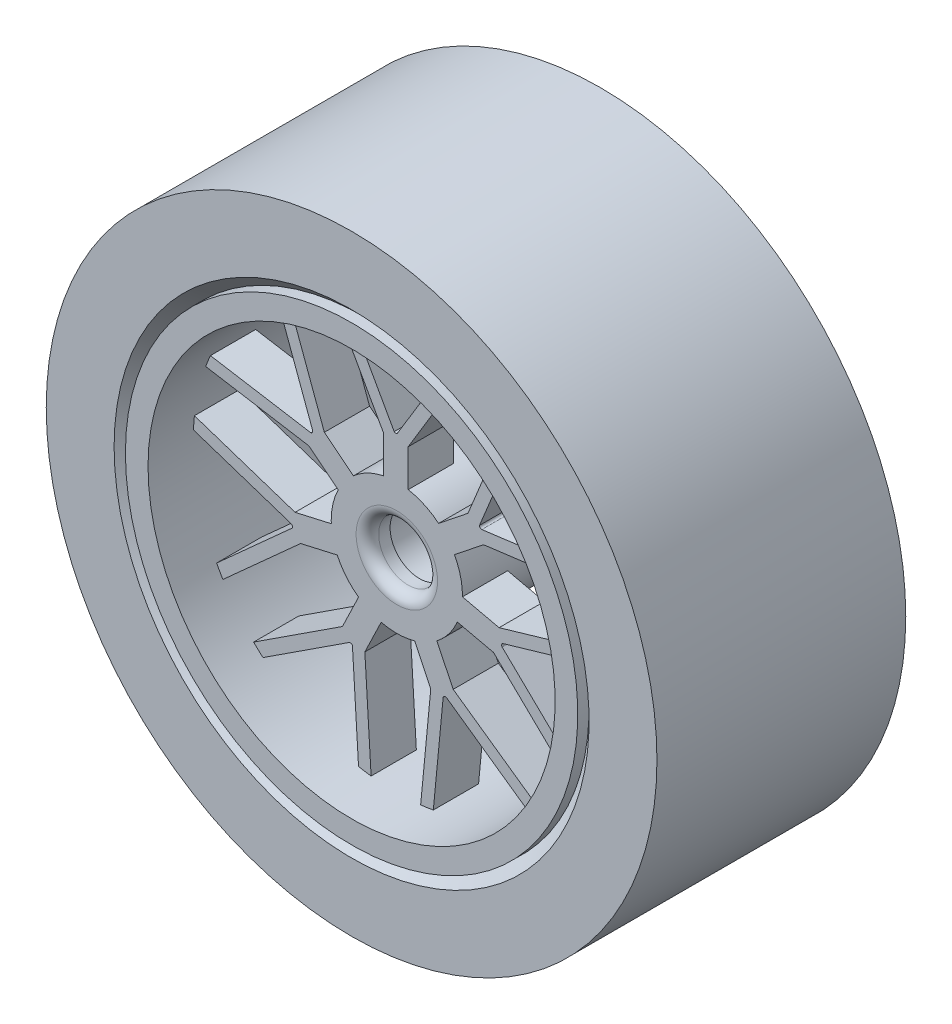
from build123d import *

# Parameters (mm, degrees)
CUT_EXTRUDE1_START  = -9
SKETCH3_R           = 9
SKETCH3_R_2         = 2.9
CUT_EXTRUDE1_DEPTH  = 9
BOSS_EXTRUDE1_DEPTH = 2
CIRPATTERN1_COUNT   = 7
SKETCH5_R           = 2.9
SKETCH5_R_2         = 1.3
BOSS_EXTRUDE2_DEPTH = 1
FILLET2_R           = 0.5


with BuildPart() as part:
    # Sketch1 → Revolve1 (revolve)
    with BuildSketch(Plane(origin=(0, 0, 0), x_dir=(1, 0, 0), z_dir=(0, 1, 0))):
        Polygon((-1.7, 0), (-1.7, -5), (-1.4, -5.5), (-1.5, -6), (-1.5, -8), (-2.5, -8), (-2.5, -9), (-9, -9), (-9, -11), (-10, -11), (-10, -10.5), (-10.5, -11), (-13.5, -11), (-13.5, 0), align=None)
    revolve(axis=Axis((0, 0, 0), (0, 0, 1)))

    # Sketch3 → Cut-Extrude1 (cut)
    with BuildSketch(Plane(origin=(0, 0, 0), x_dir=(-1, 0, 0), z_dir=(0, 0, -1)).offset(CUT_EXTRUDE1_START)):
        Circle(SKETCH3_R)
        Circle(SKETCH3_R_2, mode=Mode.SUBTRACT)
    extrude(amount=CUT_EXTRUDE1_DEPTH, mode=Mode.SUBTRACT)


with BuildPart() as cut_extrude1_piece_1:
    # of the separate pieces the step leaves, piece 1, a body of its own (cut_extrude1_pieces)
    add(part.part.solids().sort_by_distance((-13.5, 0, 0))[0])

    # Sketch2 → Boss-Extrude1 (add)
    with BuildSketch(Plane.XY.offset(9)):
        with BuildLine():
            Line((-0.597826087, 4.5), (-2.848883013, 8.537204787))
            Line((-2.848883013, 8.537204787), (-2.342145206, 8.757766839))
            Line((-2.342145206, 8.757766839), (-0.117452618, 4.767845721))
            ThreePointArc((-0.117452618, 4.767845721), (-0.039367839, 4.74545664), (0.031677909, 4.784839446))
            Line((0.031677909, 4.784839446), (2.436897987, 8.757766839))
            Line((2.436897987, 8.757766839), (2.929718633, 8.509803096))
            Line((2.929718633, 8.509803096), (0.502173913, 4.5))
            Line((0.502173913, 4.5), (0.502173913, 2.44904499))
            ThreePointArc((0.502173913, 2.44904499), (-0.049135224, 2.504998888), (-0.597826087, 2.427468634))
            Line((-0.597826087, 2.427468634), (-0.597826087, 4.5))
        make_face()
    boss_extrude1 = extrude(amount=-BOSS_EXTRUDE1_DEPTH)

    # CirPattern1: Boss-Extrude1 ×7 about axis
    cirpattern1_axis = Axis((0, 0, 0), (0, 0, 1))
    for i in range(1, CIRPATTERN1_COUNT):
        add(boss_extrude1.rotate(cirpattern1_axis, i * 360 / CIRPATTERN1_COUNT))



with BuildPart() as cut_extrude1_piece_2:
    # of the separate pieces the step leaves, piece 2, a body of its own (cut_extrude1_pieces)
    add(part.part.solids().sort_by_distance((-1.7, 0, 0))[0])


with BuildPart() as cut_extrude1_piece_1_1:
    add(cut_extrude1_piece_1.part)

    add(cut_extrude1_piece_2.part)  # Boss-Extrude2 merges Cut-Extrude1 piece 2
    # Sketch5 → Boss-Extrude2 (add)
    with BuildSketch(Plane.XY.offset(8)):
        with Locations(Location((0, 0, 0), (0, 0, 180))):
            Circle(SKETCH5_R)
        Circle(SKETCH5_R_2, mode=Mode.SUBTRACT)
    extrude(amount=BOSS_EXTRUDE2_DEPTH)

    # Fillet2
    fillet2_edges = [cut_extrude1_piece_1_1.edges().sort_by_distance(p)[0] for p in [
        (-1.3, 0, 9),
    ]]
    fillet(fillet2_edges, radius=FILLET2_R)


solid = cut_extrude1_piece_1_1.part
